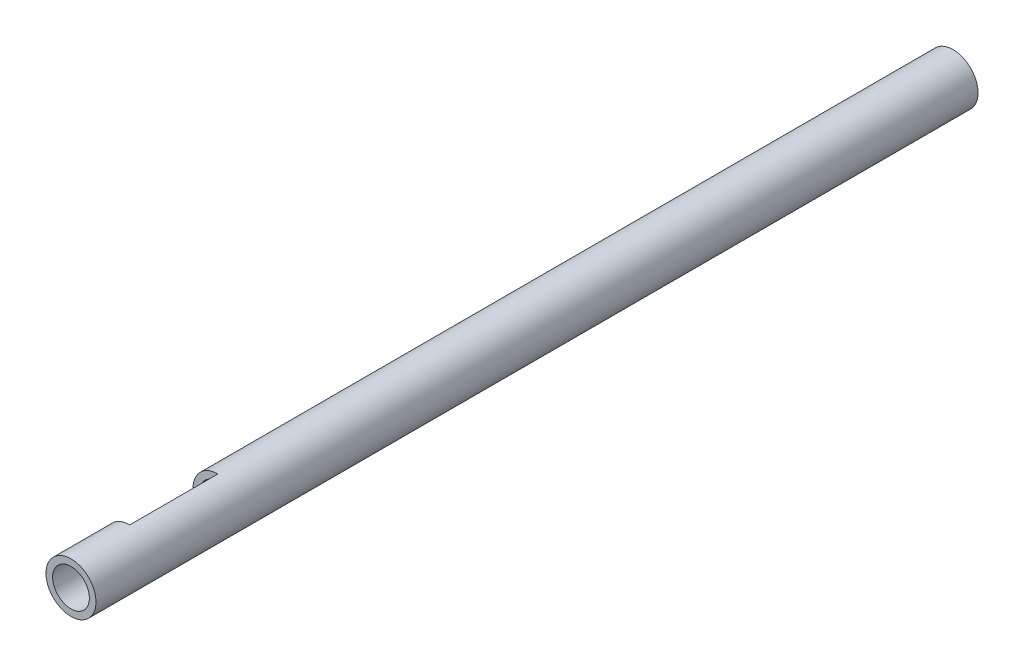
from build123d import *

# Parameters (mm, degrees)
SKETCH1_W               = 600
SKETCH1_H               = 4.5
CUT_EXTRUDE1_DEPTH      = 601.481473486
CUT_EXTRUDE1_DEPTH_BACK = 601.481473486
SKETCH2_W               = 37.714751534
SKETCH2_H               = 60


with BuildPart() as part:
    # Sketch1 → Revolve1 (revolve)
    with BuildSketch(Plane(origin=(0, 0, 0), x_dir=(0, 0, -1), z_dir=(1, 0, 0)), mode=Mode.PRIVATE) as revolve1_sk:
        with Locations((-300, 14.75)):
            Rectangle(SKETCH1_W, SKETCH1_H)
    revolve(revolve1_sk.sketch.rotate(Axis((0, 0, 0), (0, 0, 1)), 90), axis=Axis((0, 0, 0), (0, 0, 1)))

    # Sketch2 → Cut-Extrude1 (cut, two sides: drawn at the far end of the back side and taken through both)
    with BuildSketch(Plane(origin=(0, 0, 0), x_dir=(1, 0, 0), z_dir=(0, 1, 0)).offset(-CUT_EXTRUDE1_DEPTH_BACK)):
        with Locations((-18.857375767, -530)):
            Rectangle(SKETCH2_W, SKETCH2_H)
    extrude(amount=CUT_EXTRUDE1_DEPTH + CUT_EXTRUDE1_DEPTH_BACK, mode=Mode.SUBTRACT)


solid = part.part
